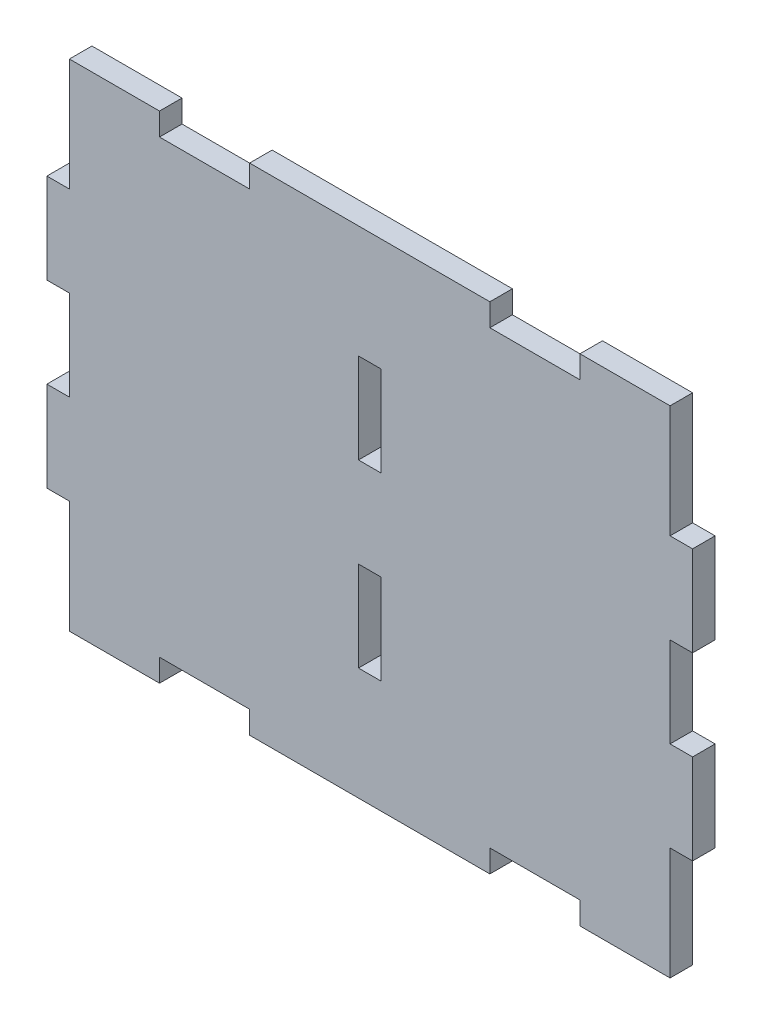
from build123d import *

# Parameters (mm, degrees)
ESBO_O1_W                = 3
ESBO_O1_H                = 12
RESSALTO_EXTRUS_O1_DEPTH = 3


with BuildPart() as part:
    # Esboço1 → Ressalto-extrusão1 (new body)
    with BuildSketch(Plane.XY):
        Polygon((-31.216896784, 9.909791424), (-31.216896784, -2.090208576), (-34.216896784, -2.090208576), (-34.216896784, -14.090208576), (-31.216896784, -14.090208576), (-31.216896784, -26.090208576), (-31.216896784, -29.090208576), (-19.216896784, -29.090208576), (-19.216896784, -26.090208576), (-7.216896784, -26.090208576), (-7.216896784, -29.090208576), (24.783103216, -29.090208576), (24.783103216, -26.090208576), (36.783103216, -26.090208576), (36.783103216, -29.090208576), (48.783103216, -29.090208576), (48.783103216, -26.090208576), (48.783103216, -14.090208576), (51.783103216, -14.090208576), (51.783103216, -2.090208576), (48.783103216, -2.090208576), (48.783103216, 9.909791424), (51.783103216, 9.909791424), (51.783103216, 21.909791424), (48.783103216, 21.909791424), (48.783103216, 33.909791424), (48.783103216, 36.909791424), (36.783103216, 36.909791424), (36.783103216, 33.909791424), (24.783103216, 33.909791424), (24.783103216, 36.909791424), (-7.216896784, 36.909791424), (-7.216896784, 33.909791424), (-19.216896784, 33.909791424), (-19.216896784, 36.909791424), (-31.216896784, 36.909791424), (-31.216896784, 33.909791424), (-31.216896784, 21.909791424), (-34.216896784, 21.909791424), (-34.216896784, 9.909791424), align=None)
        with Locations((8.783103216, -8.090208576)):
            Rectangle(ESBO_O1_W, ESBO_O1_H, mode=Mode.SUBTRACT)
        with Locations((8.783103216, 15.909791424)):
            Rectangle(ESBO_O1_W, ESBO_O1_H, mode=Mode.SUBTRACT)
    extrude(amount=RESSALTO_EXTRUS_O1_DEPTH)


solid = part.part
